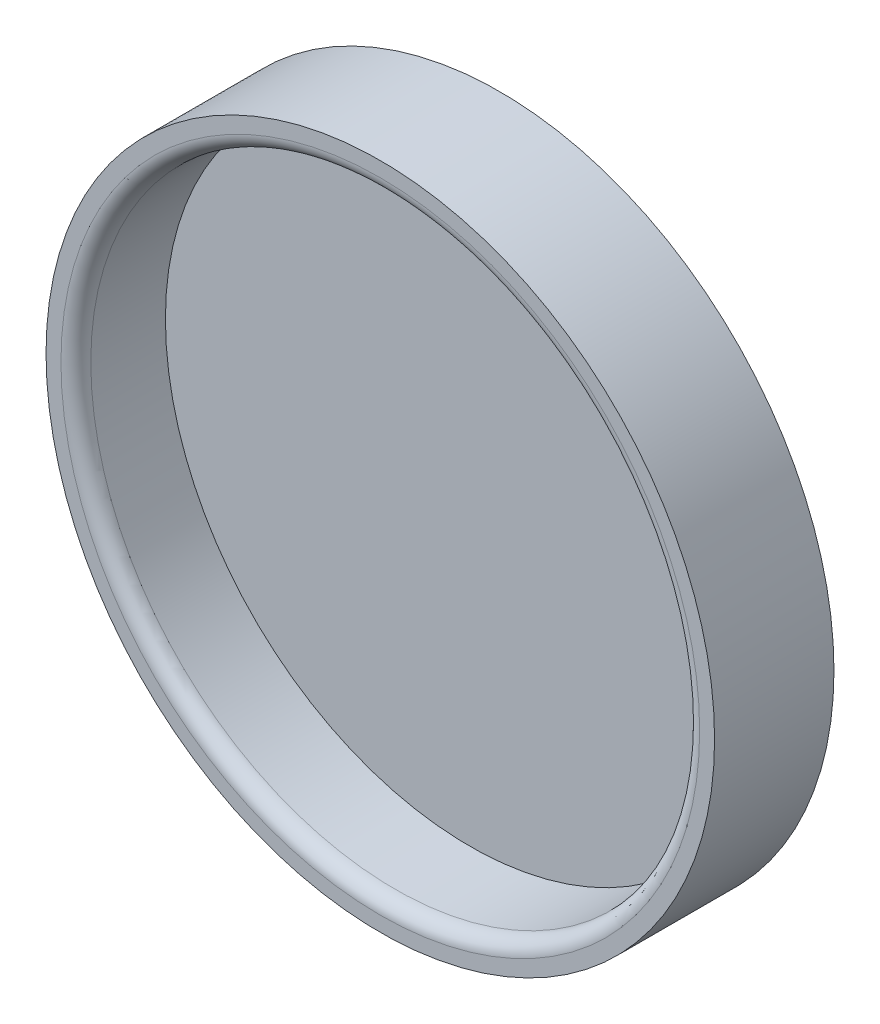
from build123d import *

# Parameters (mm, degrees)
SKETCH1_R           = 11.2
BOSS_EXTRUDE1_DEPTH = 1
SKETCH2_R           = 11.2
SKETCH2_R_2         = 10.2
BOSS_EXTRUDE2_DEPTH = 3
FILLET1_R           = 0.5


with BuildPart() as part:
    # Sketch1 → Boss-Extrude1 (new body)
    with BuildSketch(Plane.XY):
        Circle(SKETCH1_R)
    extrude(amount=BOSS_EXTRUDE1_DEPTH)

    # Sketch2 → Boss-Extrude2 (add)
    with BuildSketch(Plane.XY.offset(1)):
        Circle(SKETCH2_R)
        Circle(SKETCH2_R_2, mode=Mode.SUBTRACT)
    extrude(amount=BOSS_EXTRUDE2_DEPTH)

    # Fillet1
    fillet1_edges = [part.edges().sort_by_distance(p)[0] for p in [
        (-10.2, 0, 4),
    ]]
    fillet(fillet1_edges, radius=FILLET1_R)


solid = part.part
